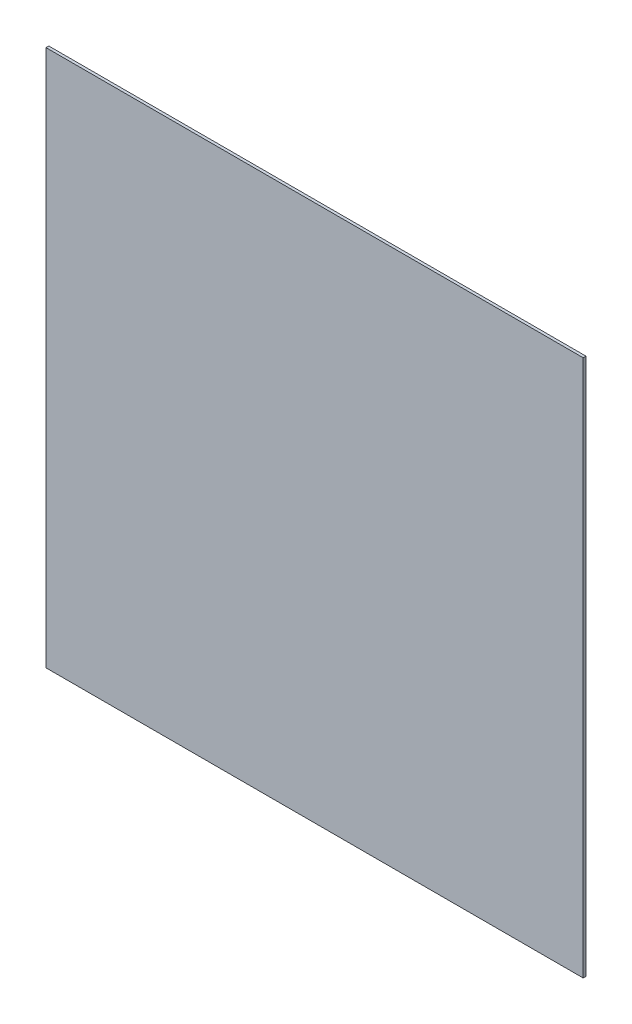
from build123d import *

# Parameters (mm, degrees)
SKETCH3_W           = 304.8
SKETCH3_H           = 304.8
BOSS_EXTRUDE1_DEPTH = 0.79375


with BuildPart() as part:
    # Sketch3 → Boss-Extrude1 (new, symmetric)
    with BuildSketch(Plane.XY):
        Rectangle(SKETCH3_W, SKETCH3_H)
    extrude(amount=BOSS_EXTRUDE1_DEPTH, both=True)


solid = part.part
